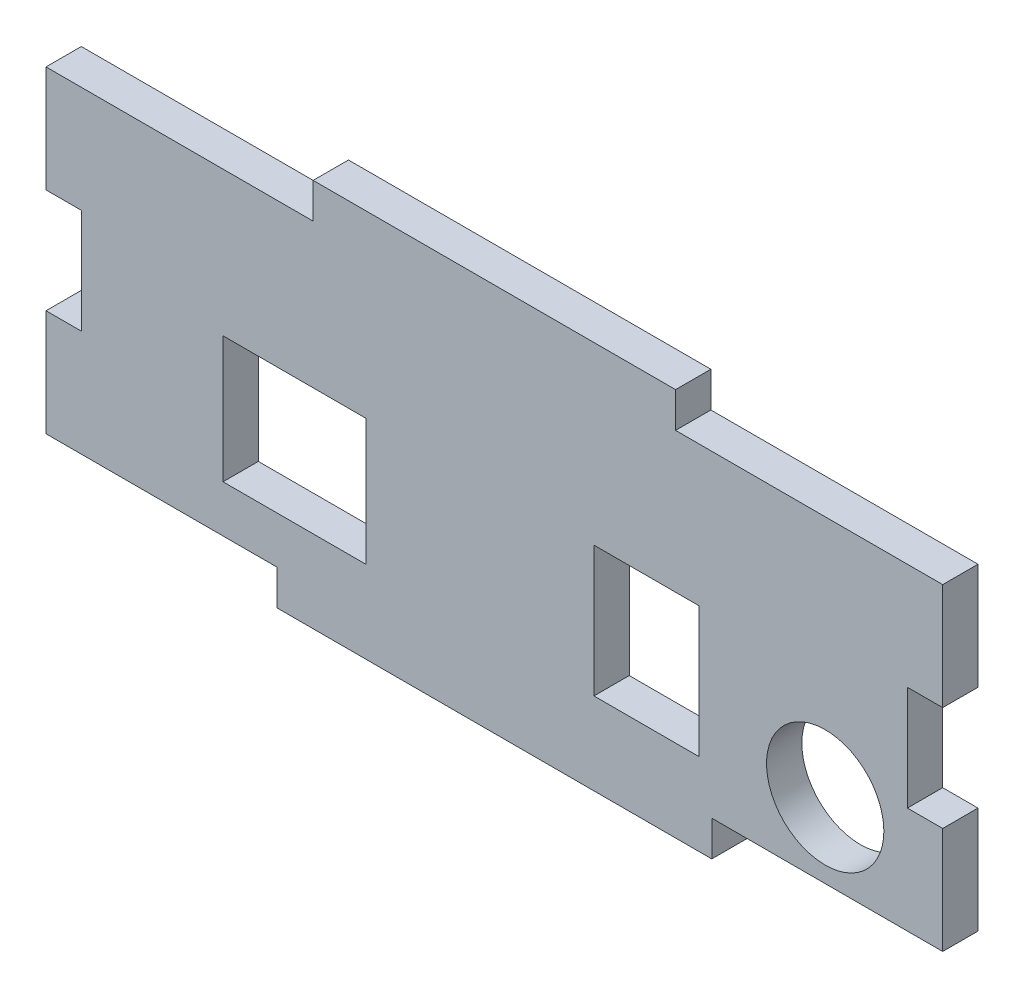
from build123d import *

# Parameters (mm, degrees)
SKETCH_1_W          = 76.2
SKETCH_1_H          = 30
SKETCH_1_W_2        = 8.9408
SKETCH_1_H_2        = 11.0998
SKETCH_1_W_3        = 12.1539
SKETCH_1_H_3        = 10.7442
EXTRUDE_1_DEPTH     = 3
SKETCH_2_W          = 19.6215
SKETCH_2_H          = 3
CUT_EXTRUDE_1_DEPTH = 3
SKETCH_3_W          = 3
SKETCH_3_H          = 8.89
CUT_EXTRUDE_2_DEPTH = 3
SKETCH_4_W          = 30.7975
SKETCH_4_H          = 3
EXTRUDE_2_DEPTH     = 3
SKETCH_5_R          = 4.98475
CUT_EXTRUDE_3_DEPTH = 3


with BuildPart() as part:
    # 스케치1 → 보스-돌출1 (new body)
    with BuildSketch(Plane.XY):
        Rectangle(SKETCH_1_W, SKETCH_1_H)
        with Locations((12.9343, -2.4623)):
            Rectangle(SKETCH_1_W_2, SKETCH_1_H_2, mode=Mode.SUBTRACT)
        with Locations((-16.98055, -2.6401)):
            Rectangle(SKETCH_1_W_3, SKETCH_1_H_3, mode=Mode.SUBTRACT)
    extrude(amount=EXTRUDE_1_DEPTH)

    # 스케치2 → 컷-돌출1 (cut)
    with BuildSketch(Plane.XY.offset(3)):
        with Locations((-28.28925, -13.5)):
            Rectangle(SKETCH_2_W, SKETCH_2_H)
        with Locations((28.28925, -13.5)):
            Rectangle(SKETCH_2_W, SKETCH_2_H)
    extrude(amount=-CUT_EXTRUDE_1_DEPTH, mode=Mode.SUBTRACT)

    # 스케치3 → 컷-돌출2 (cut)
    with BuildSketch(Plane.XY.offset(3)):
        with Locations((-36.6, 1.5)):
            Rectangle(SKETCH_3_W, SKETCH_3_H)
        with Locations((36.6, 1.5)):
            Rectangle(SKETCH_3_W, SKETCH_3_H)
    extrude(amount=-CUT_EXTRUDE_2_DEPTH, mode=Mode.SUBTRACT)

    # 스케치4 → 보스-돌출2 (add)
    with BuildSketch(Plane.XY.offset(3)):
        with Locations((0, 16.5)):
            Rectangle(SKETCH_4_W, SKETCH_4_H)
    extrude(amount=-EXTRUDE_2_DEPTH)

    # 스케치5 → 컷-돌출3 (cut)
    with BuildSketch(Plane.XY.offset(3)):
        with Locations((28.115, -5.65)):
            Circle(SKETCH_5_R)
    extrude(amount=-CUT_EXTRUDE_3_DEPTH, mode=Mode.SUBTRACT)


solid = part.part
